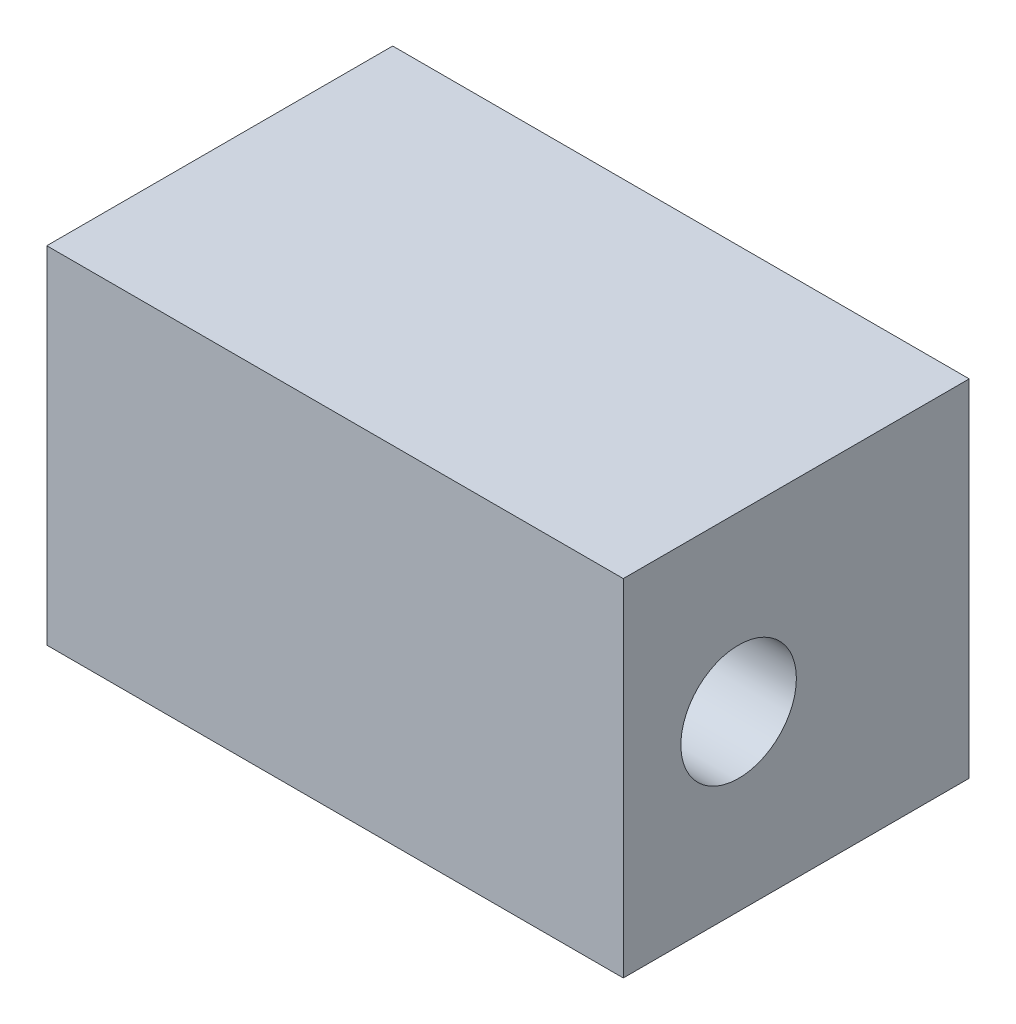
from build123d import *

# Parameters (mm, degrees)
SKETCH1_W           = 38.1
SKETCH1_H           = 38.1
BOSS_EXTRUDE1_DEPTH = 63.5
SKETCH2_R           = 6.3627
CUT_EXTRUDE1_DEPTH  = 57.15
SKETCH6_R           = 2.0193
CUT_EXTRUDE4_DEPTH  = 12.7
SKETCH7_R           = 0.635
CUT_EXTRUDE5_DEPTH  = 22.86


with BuildPart() as part:
    # Sketch1 → Boss-Extrude1 (new body)
    with BuildSketch(Plane(origin=(0, 0, 0), x_dir=(0, 0, -1), z_dir=(1, 0, 0))):
        with Locations((-5.123793103, -0.262758621)):
            Rectangle(SKETCH1_W, SKETCH1_H)
    extrude(amount=-BOSS_EXTRUDE1_DEPTH)

    # Sketch2 → Cut-Extrude1 (cut)
    with BuildSketch(Plane(origin=(0, 0, 0), x_dir=(0, 0, -1), z_dir=(1, 0, 0))):
        with Locations((-11.473793103, -0.262758621)):
            Circle(SKETCH2_R)
    extrude(amount=-CUT_EXTRUDE1_DEPTH, mode=Mode.SUBTRACT)

    # Sketch6 → Cut-Extrude4 (cut)
    with BuildSketch(Plane(origin=(0, 0, -13.926206897), x_dir=(-1, 0, 0), z_dir=(0, 0, -1))):
        with Locations(Location((25.4, -0.262758621, 0), (0, 0, 90))):
            Circle(SKETCH6_R)
    extrude(amount=-CUT_EXTRUDE4_DEPTH, mode=Mode.SUBTRACT)

    # Sketch7 → Cut-Extrude5 (cut)
    with BuildSketch(Plane(origin=(0, 0, -13.926206897), x_dir=(-1, 0, 0), z_dir=(0, 0, -1))):
        with Locations(Location((50.8, -0.262758621, 0), (0, 0, 90))):
            Circle(SKETCH7_R)
    extrude(amount=-CUT_EXTRUDE5_DEPTH, mode=Mode.SUBTRACT)


solid = part.part
